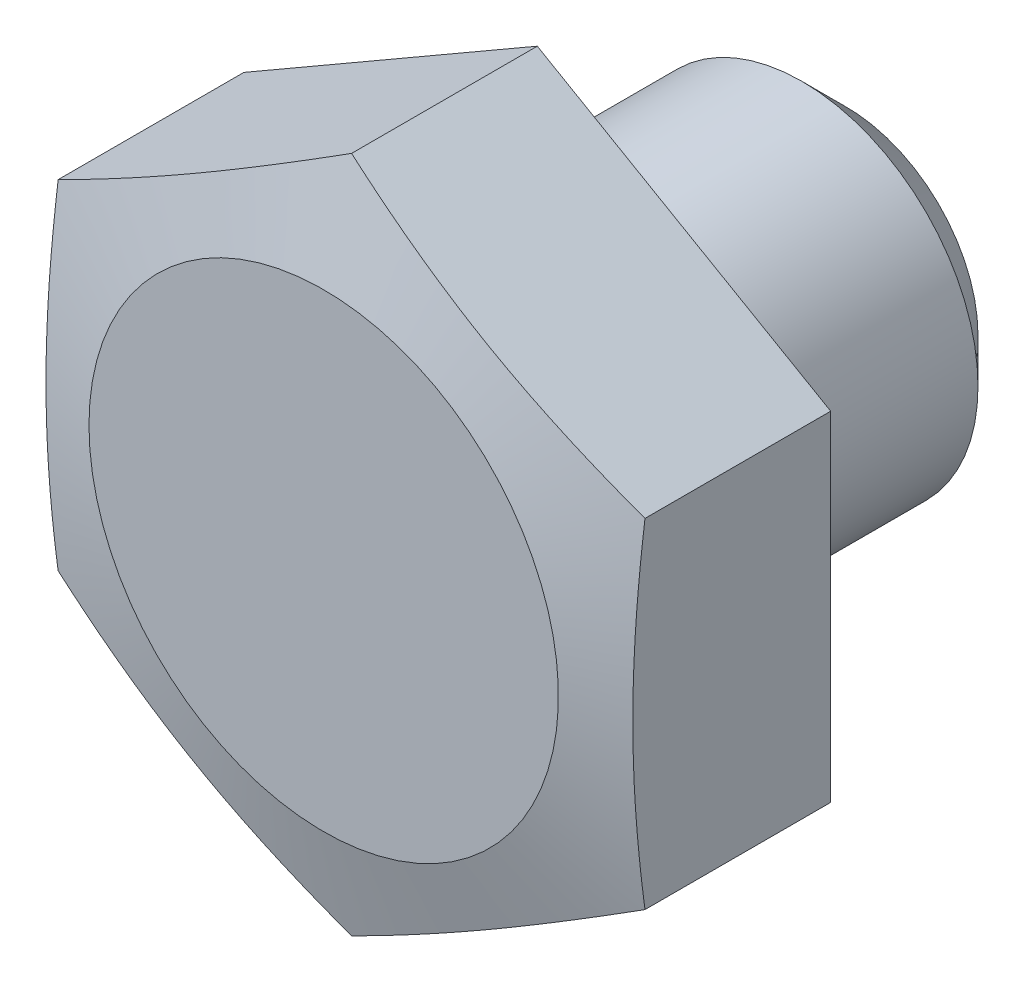
from build123d import *

# Parameters (mm, degrees)
EXTRUDE_1_DEPTH     = 3.9
SKETCH_3_R          = 3
EXTRUDE_3_DEPTH     = 5
CHAMFER_1_SIZE      = 0.75
SKETCH_2_OUTSIDE_W  = 15.536
SKETCH_2_OUTSIDE_H  = 17.084
SKETCH_2_OUTSIDE_R  = 4.5
CUT_EXTRUDE_1_DEPTH = 0.26
FILLET_1_R          = 0.1


with BuildPart() as part:
    # 草图1 → 凸台-拉伸1 (new body)
    with BuildSketch(Plane.XY):
        Polygon((0, 5.773502692), (-5, 2.886751346), (-5, -2.886751346), (0, -5.773502692), (5, -2.886751346), (5, 2.886751346), align=None)
    extrude(amount=EXTRUDE_1_DEPTH)

    # 草图3 → 凸台-拉伸3 (add)
    with BuildSketch(Plane.XY):
        Circle(SKETCH_3_R)
    extrude(amount=-EXTRUDE_3_DEPTH)

    # 草图4 → 切除-旋转1 (revolve, cut)
    with BuildSketch(Plane(origin=(0, 0, 0), x_dir=(0, 0, -1), z_dir=(1, 0, 0))):
        Polygon((-3.9, 20), (-3.9, 4), (0.387187079, 20), align=None)
    revolve(axis=Axis((0, 0, -2.242017917), (0, 0, 1)), mode=Mode.SUBTRACT)

    # 倒角1
    chamfer_1_edges = [part.edges().sort_by_distance(p)[0] for p in [
        (-3, 0, -5),
    ]]
    chamfer(chamfer_1_edges, length=CHAMFER_1_SIZE)

    # 草图2 outside → 切除-拉伸1 (cut)
    with BuildSketch(Plane.XY):
        Rectangle(SKETCH_2_OUTSIDE_W, SKETCH_2_OUTSIDE_H)
        Circle(SKETCH_2_OUTSIDE_R, mode=Mode.SUBTRACT)
    extrude(amount=CUT_EXTRUDE_1_DEPTH, mode=Mode.SUBTRACT)

    # 圆角1
    fillet_1_edges = [part.edges().sort_by_distance(p)[0] for p in [
        (-3, 0, 0),
    ]]
    fillet(fillet_1_edges, radius=FILLET_1_R)


solid = part.part
